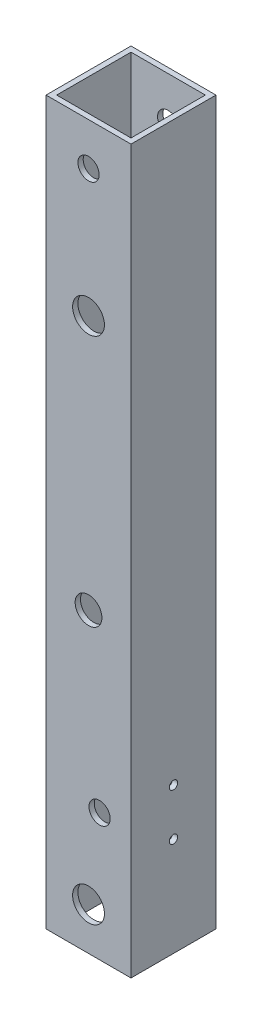
from build123d import *

# Parameters (mm, degrees)
SKETCH1_W           = 25.4
SKETCH1_H           = 25.4
SKETCH1_W_2         = 22.225
SKETCH1_H_2         = 22.225
BOSS_EXTRUDE1_DEPTH = 215.9
SKETCH2_R           = 4
SKETCH2_R_2         = 4.7625
SKETCH2_R_3         = 3.175
CUT_EXTRUDE1_DEPTH  = 218.759638133
SKETCH3_R           = 3.175
CUT_EXTRUDE2_DEPTH  = 218.759638133
SKETCH5_R           = 1.25
CUT_EXTRUDE3_DEPTH  = 218.759638133


with BuildPart() as part:
    # Sketch1 → Boss-Extrude1 (new body)
    with BuildSketch(Plane(origin=(0, 0, 0), x_dir=(1, 0, 0), z_dir=(0, 1, 0))):
        Rectangle(SKETCH1_W, SKETCH1_H)
        Rectangle(SKETCH1_W_2, SKETCH1_H_2, mode=Mode.SUBTRACT)
    extrude(amount=BOSS_EXTRUDE1_DEPTH)

    # Sketch2 → Cut-Extrude1 (cut, through all)
    with BuildSketch(Plane.XY.offset(12.7)):
        with Locations((0, 88.9)):
            Circle(SKETCH2_R)
        with Locations((0, 165.1)):
            Circle(SKETCH2_R_2)
        with Locations((0, 12.7)):
            Circle(SKETCH2_R_2)
        with Locations((0, 203.2)):
            Circle(SKETCH2_R_3)
    extrude(amount=-CUT_EXTRUDE1_DEPTH, mode=Mode.SUBTRACT)

    # Sketch3 → Cut-Extrude2 (cut, through all)
    with BuildSketch(Plane.XY.offset(12.7)):
        with Locations((3.302, 38.1)):
            Circle(SKETCH3_R)
    extrude(amount=-CUT_EXTRUDE2_DEPTH, mode=Mode.SUBTRACT)

    # Sketch5 → Cut-Extrude3 (cut, through all)
    with BuildSketch(Plane.ZY.offset(12.7)):
        with Locations((0, 43.6)):
            Circle(SKETCH5_R)
        with Locations((0, 29.6)):
            Circle(SKETCH5_R)
    extrude(amount=-CUT_EXTRUDE3_DEPTH, mode=Mode.SUBTRACT)


solid = part.part
